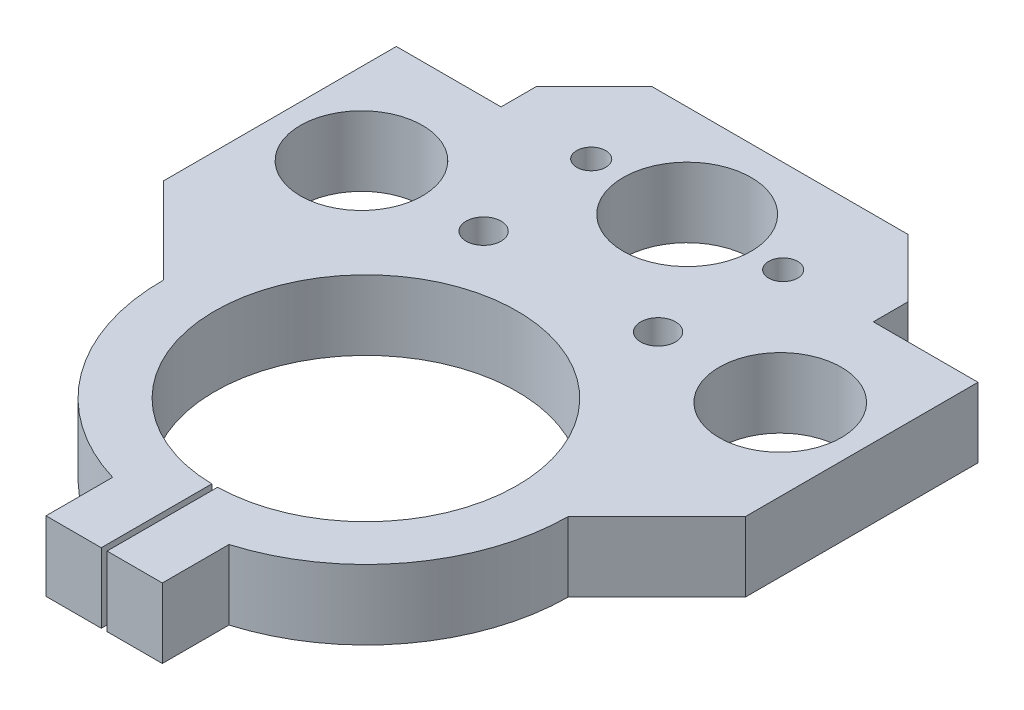
from build123d import *

# Parameters (mm, degrees)
SKETCH1_W           = 100
SKETCH1_H           = 100
SKETCH1_R           = 11
BOSS_EXTRUDE1_DEPTH = 12
SKETCH9_W           = 100
SKETCH9_H           = 50
BOSS_EXTRUDE3_DEPTH = 12
CUT_EXTRUDE3_REACH  = 114.446
SKETCH4_R           = 10.5
CUT_EXTRUDE4_REACH  = 114.446
CUT_EXTRUDE5_REACH  = 114.446
SKETCH6_R           = 26
CUT_EXTRUDE6_REACH  = 114.446
CUT_EXTRUDE7_REACH  = 114.446
SKETCH11_R          = 2.5
CHAMFER1_SIZE       = 10
CUT_EXTRUDE8_REACH  = 114.446
SKETCH12_R          = 3


with BuildPart() as part:
    # Sketch1 → Boss-Extrude1 (new body)
    with BuildSketch(Plane(origin=(0, 0, 0), x_dir=(1, 0, 0), z_dir=(0, 1, 0))):
        Rectangle(SKETCH1_W, SKETCH1_H)
        with Locations(Location((0, 0, 0), (0, 0, 270))):
            Circle(SKETCH1_R, mode=Mode.SUBTRACT)
    extrude(amount=BOSS_EXTRUDE1_DEPTH)

    # Sketch9 → Boss-Extrude3 (add)
    with BuildSketch(Plane(origin=(0, 12, 0), x_dir=(1, 0, 0), z_dir=(0, 1, 0))):
        with Locations((0, -75)):
            Rectangle(SKETCH9_W, SKETCH9_H)
    extrude(amount=-BOSS_EXTRUDE3_DEPTH)

    # Sketch4 → Cut-Extrude3 (cut, up to next)
    with BuildSketch(Plane(origin=(0, 12, 0), x_dir=(1, 0, 0), z_dir=(0, 1, 0)), mode=Mode.PRIVATE) as cut_extrude3_sk1:
        with Locations(Location((-36, -20, 0), (0, 0, 270))):
            Circle(SKETCH4_R)
    cut_extrude3_tool1 = extrude(cut_extrude3_sk1.sketch, amount=-CUT_EXTRUDE3_REACH, mode=Mode.PRIVATE) & part.part
    # Sketch4 → Cut-Extrude3 (cut, up to next)
    with BuildSketch(Plane(origin=(0, 12, 0), x_dir=(1, 0, 0), z_dir=(0, 1, 0)), mode=Mode.PRIVATE) as cut_extrude3_sk2:
        with Locations(Location((36, -20, 0), (0, 0, 270))):
            Circle(SKETCH4_R)
    cut_extrude3_tool2 = extrude(cut_extrude3_sk2.sketch, amount=-CUT_EXTRUDE3_REACH, mode=Mode.PRIVATE) & part.part
    add(cut_extrude3_tool1.solids().sort_by_distance((-36, 12, 20))[0], mode=Mode.SUBTRACT)
    add(cut_extrude3_tool2.solids().sort_by_distance((36, 12, 20))[0], mode=Mode.SUBTRACT)

    # Sketch5 → Cut-Extrude4 (cut, up to next)
    with BuildSketch(Plane(origin=(0, 12, 0), x_dir=(1, 0, 0), z_dir=(0, 1, 0)), mode=Mode.PRIVATE) as cut_extrude4_sk1:
        Polygon((-50, 0), (-32, 0), (-32, 16), (32, 16), (32, 0), (50, 0), (50, 50), (-50, 50), align=None)
    cut_extrude4_tool1 = extrude(cut_extrude4_sk1.sketch, amount=-CUT_EXTRUDE4_REACH, mode=Mode.PRIVATE) & part.part
    add(cut_extrude4_tool1.solids().sort_by_distance((0, 12, -29.37827))[0], mode=Mode.SUBTRACT)

    # Sketch6 → Cut-Extrude5 (cut, up to next)
    with BuildSketch(Plane(origin=(0, 12, 0), x_dir=(1, 0, 0), z_dir=(0, 1, 0)), mode=Mode.PRIVATE) as cut_extrude5_sk1:
        with Locations(Location((-0.234960822, -55, 0), (0, 0, 270))):
            Circle(SKETCH6_R)
    cut_extrude5_tool1 = extrude(cut_extrude5_sk1.sketch, amount=-CUT_EXTRUDE5_REACH, mode=Mode.PRIVATE) & part.part
    add(cut_extrude5_tool1.solids().sort_by_distance((-0.234961, 12, 55))[0], mode=Mode.SUBTRACT)

    # Sketch10 → Cut-Extrude6 (cut, up to next)
    with BuildSketch(Plane(origin=(0, 12, 0), x_dir=(1, 0, 0), z_dir=(0, 1, 0)), mode=Mode.PRIVATE) as cut_extrude6_sk1:
        with BuildLine():
            Line((-10.234960822, -88.541019662), (-10.234960822, -100))
            Line((-10.234960822, -100), (-50, -100))
            Line((-50, -100), (-50, -40))
            Line((-50, -40), (-35.234177398, -54.765822602))
            ThreePointArc((-35.234177398, -54.765822602), (-28.367208461, -75.822503278), (-10.234960822, -88.541019662))
        make_face()
    cut_extrude6_tool1 = extrude(cut_extrude6_sk1.sketch, amount=-CUT_EXTRUDE6_REACH, mode=Mode.PRIVATE) & part.part
    # Sketch10 → Cut-Extrude6 (cut, up to next)
    with BuildSketch(Plane(origin=(0, 12, 0), x_dir=(1, 0, 0), z_dir=(0, 1, 0)), mode=Mode.PRIVATE) as cut_extrude6_sk2:
        with BuildLine():
            Line((9.765039178, -88.541019662), (9.765039178, -100))
            Line((9.765039178, -100), (50, -100))
            Line((50, -100), (50, -40))
            Line((50, -40), (34.764245164, -55.235754836))
            ThreePointArc((34.764245164, -55.235754836), (27.756864791, -76.010894766), (9.765039178, -88.541019662))
        make_face()
    cut_extrude6_tool2 = extrude(cut_extrude6_sk2.sketch, amount=-CUT_EXTRUDE6_REACH, mode=Mode.PRIVATE) & part.part
    # Sketch10 → Cut-Extrude6 (cut, up to next)
    with BuildSketch(Plane(origin=(0, 12, 0), x_dir=(1, 0, 0), z_dir=(0, 1, 0)), mode=Mode.PRIVATE) as cut_extrude6_sk3:
        with BuildLine():
            Line((-0.734960822, -80.995191863), (-0.734960822, -100))
            Line((-0.734960822, -100), (0.265039178, -100))
            Line((0.265039178, -100), (0.265039178, -80.995191863))
            ThreePointArc((0.265039178, -80.995191863), (-0.234960822, -81), (-0.734960822, -80.995191863))
        make_face()
    cut_extrude6_tool3 = extrude(cut_extrude6_sk3.sketch, amount=-CUT_EXTRUDE6_REACH, mode=Mode.PRIVATE) & part.part
    add(cut_extrude6_tool1.solids().sort_by_distance((-35.978986, 12, 79.410224))[0], mode=Mode.SUBTRACT)
    add(cut_extrude6_tool2.solids().sort_by_distance((35.780347, 12, 79.379296))[0], mode=Mode.SUBTRACT)
    add(cut_extrude6_tool3.solids().sort_by_distance((-0.234961, 12, 90.499199))[0], mode=Mode.SUBTRACT)

    # Sketch11 → Cut-Extrude7 (cut, up to next)
    with BuildSketch(Plane(origin=(0, 12, 0), x_dir=(1, 0, 0), z_dir=(0, 1, 0)), mode=Mode.PRIVATE) as cut_extrude7_sk1:
        with Locations(Location((-16.5, 0, 0), (0, 0, 270))):
            Circle(SKETCH11_R)
    cut_extrude7_tool1 = extrude(cut_extrude7_sk1.sketch, amount=-CUT_EXTRUDE7_REACH, mode=Mode.PRIVATE) & part.part
    # Sketch11 → Cut-Extrude7 (cut, up to next)
    with BuildSketch(Plane(origin=(0, 12, 0), x_dir=(1, 0, 0), z_dir=(0, 1, 0)), mode=Mode.PRIVATE) as cut_extrude7_sk2:
        with Locations(Location((16.5, 0, 0), (0, 0, 270))):
            Circle(SKETCH11_R)
    cut_extrude7_tool2 = extrude(cut_extrude7_sk2.sketch, amount=-CUT_EXTRUDE7_REACH, mode=Mode.PRIVATE) & part.part
    add(cut_extrude7_tool1.solids().sort_by_distance((-16.5, 12, 0))[0], mode=Mode.SUBTRACT)
    add(cut_extrude7_tool2.solids().sort_by_distance((16.5, 12, 0))[0], mode=Mode.SUBTRACT)

    # Chamfer1
    chamfer1_edges = [part.edges().sort_by_distance(p)[0] for p in [
        (32, 6, -16),
        (-32, 6, -16),
    ]]
    chamfer(chamfer1_edges, length=CHAMFER1_SIZE)

    # Sketch12 → Cut-Extrude8 (cut, up to next)
    with BuildSketch(Plane(origin=(0, 12, 0), x_dir=(1, 0, 0), z_dir=(0, 1, 0)), mode=Mode.PRIVATE) as cut_extrude8_sk1:
        with Locations(Location((15, -20, 0), (0, 0, 270))):
            Circle(SKETCH12_R)
    cut_extrude8_tool1 = extrude(cut_extrude8_sk1.sketch, amount=-CUT_EXTRUDE8_REACH, mode=Mode.PRIVATE) & part.part
    # Sketch12 → Cut-Extrude8 (cut, up to next)
    with BuildSketch(Plane(origin=(0, 12, 0), x_dir=(1, 0, 0), z_dir=(0, 1, 0)), mode=Mode.PRIVATE) as cut_extrude8_sk2:
        with Locations(Location((-15, -20, 0), (0, 0, 270))):
            Circle(SKETCH12_R)
    cut_extrude8_tool2 = extrude(cut_extrude8_sk2.sketch, amount=-CUT_EXTRUDE8_REACH, mode=Mode.PRIVATE) & part.part
    add(cut_extrude8_tool1.solids().sort_by_distance((15, 12, 20))[0], mode=Mode.SUBTRACT)
    add(cut_extrude8_tool2.solids().sort_by_distance((-15, 12, 20))[0], mode=Mode.SUBTRACT)


solid = part.part
